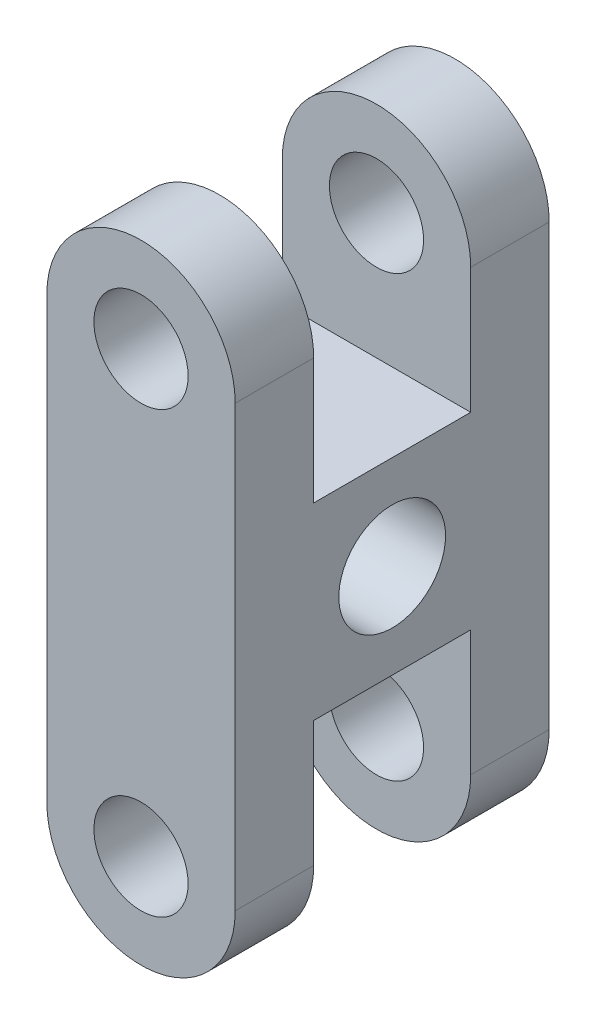
from build123d import *

# Parameters (mm, degrees)
ESBO_O2_R                  = 3
RESSALTO_EXTRUS_O1_DEPTH   = 20
CORTE_EXTRUS_O1_DEPTH      = 29.91366459
CORTE_EXTRUS_O1_DEPTH_BACK = 29.91366459
ESBO_O3_R                  = 3.4
ESBO_O3_W                  = 10
ESBO_O3_H                  = 14


with BuildPart() as part:
    # Esboço2 → Ressalto-extrusão1 (new body)
    with BuildSketch(Plane.XY):
        with BuildLine():
            Line((-6, -14), (-6, 14))
            ThreePointArc((-6, 14), (0, 20), (6, 14))
            Line((6, 14), (6, -14))
            ThreePointArc((6, -14), (0, -20), (-6, -14))
        make_face()
        with Locations((0, -14)):
            Circle(ESBO_O2_R, mode=Mode.SUBTRACT)
        with Locations((0, 14)):
            Circle(ESBO_O2_R, mode=Mode.SUBTRACT)
    extrude(amount=RESSALTO_EXTRUS_O1_DEPTH)

    # Esboço3 → Corte-extrusão1 (cut, two sides: drawn at the far end of the back side and taken through both)
    with BuildSketch(Plane(origin=(0, 0, 0), x_dir=(0, 0, -1), z_dir=(1, 0, 0)).offset(-CORTE_EXTRUS_O1_DEPTH_BACK)):
        with Locations((-10, 0)):
            Circle(ESBO_O3_R)
        with Locations((-10, -13)):
            Rectangle(ESBO_O3_W, ESBO_O3_H)
        with Locations((-10, 13)):
            Rectangle(ESBO_O3_W, ESBO_O3_H)
    extrude(amount=CORTE_EXTRUS_O1_DEPTH + CORTE_EXTRUS_O1_DEPTH_BACK, mode=Mode.SUBTRACT)


solid = part.part
